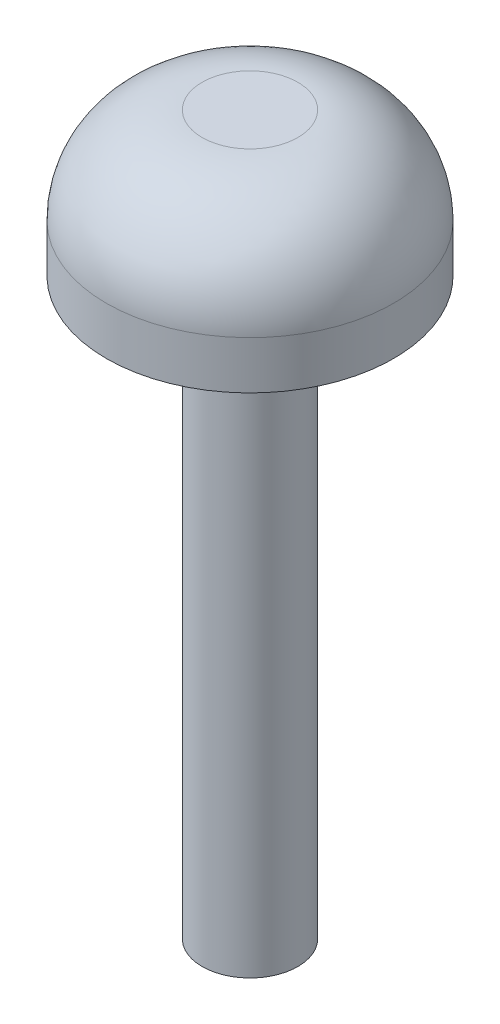
from build123d import *

# Parameters (mm, degrees)
SKETCH1_R           = 0.5
BOSS_EXTRUDE1_DEPTH = 6
SKETCH2_R           = 1.5
BOSS_EXTRUDE2_DEPTH = 1.5
FILLET1_R           = 1


with BuildPart() as part:
    # Sketch1 → Boss-Extrude1 (new body)
    with BuildSketch(Plane(origin=(0, 0, 0), x_dir=(1, 0, 0), z_dir=(0, 1, 0))):
        with Locations(Location((0, 0, 0), (0, 0, 270))):
            Circle(SKETCH1_R)
    extrude(amount=BOSS_EXTRUDE1_DEPTH)

    # Sketch2 → Boss-Extrude2 (add)
    with BuildSketch(Plane(origin=(0, 6, 0), x_dir=(1, 0, 0), z_dir=(0, 1, 0))):
        with Locations(Location((0, 0, 0), (0, 0, 270))):
            Circle(SKETCH2_R)
    extrude(amount=BOSS_EXTRUDE2_DEPTH)

    # Fillet1
    fillet1_edges = [part.edges().sort_by_distance(p)[0] for p in [
        (0, 7.5, -1.5),
    ]]
    fillet(fillet1_edges, radius=FILLET1_R)


solid = part.part
